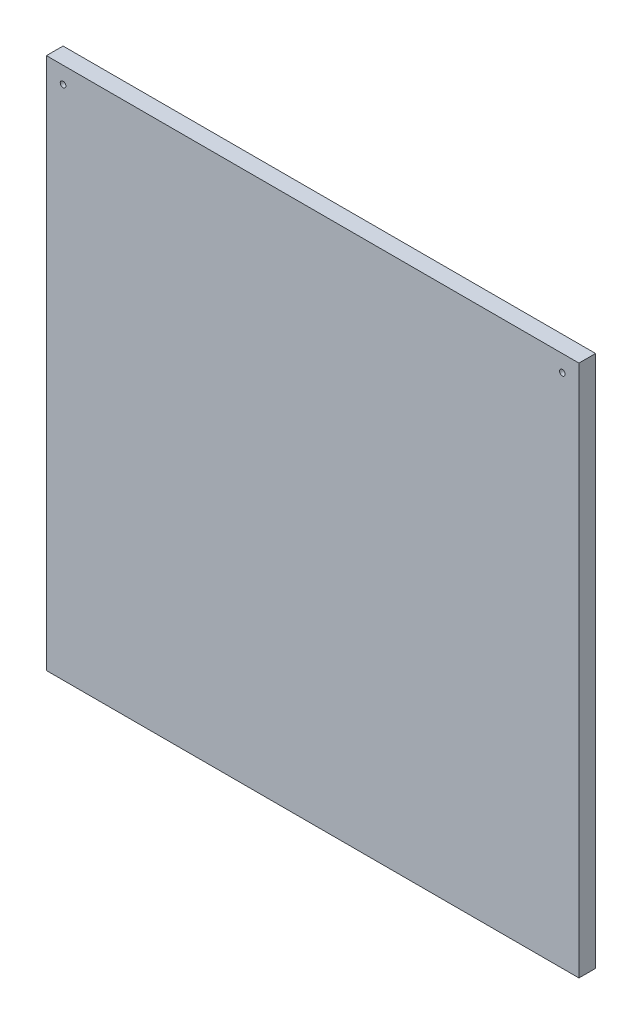
from build123d import *

# Parameters (mm, degrees)
SKETCH1_W           = 800
SKETCH1_H           = 800
BOSS_EXTRUDE1_DEPTH = 25
SKETCH2_R           = 4.25
CUT_EXTRUDE1_DEPTH  = 25


with BuildPart() as part:
    # Sketch1 → Boss-Extrude1 (new body)
    with BuildSketch(Plane.XY):
        Rectangle(SKETCH1_W, SKETCH1_H)
    extrude(amount=BOSS_EXTRUDE1_DEPTH)

    # Sketch2 → Cut-Extrude1 (cut)
    with BuildSketch(Plane.XY.offset(25)):
        with Locations((375, 375)):
            Circle(SKETCH2_R)
        with Locations((-375, 375)):
            Circle(SKETCH2_R)
    extrude(amount=-CUT_EXTRUDE1_DEPTH, mode=Mode.SUBTRACT)


solid = part.part
